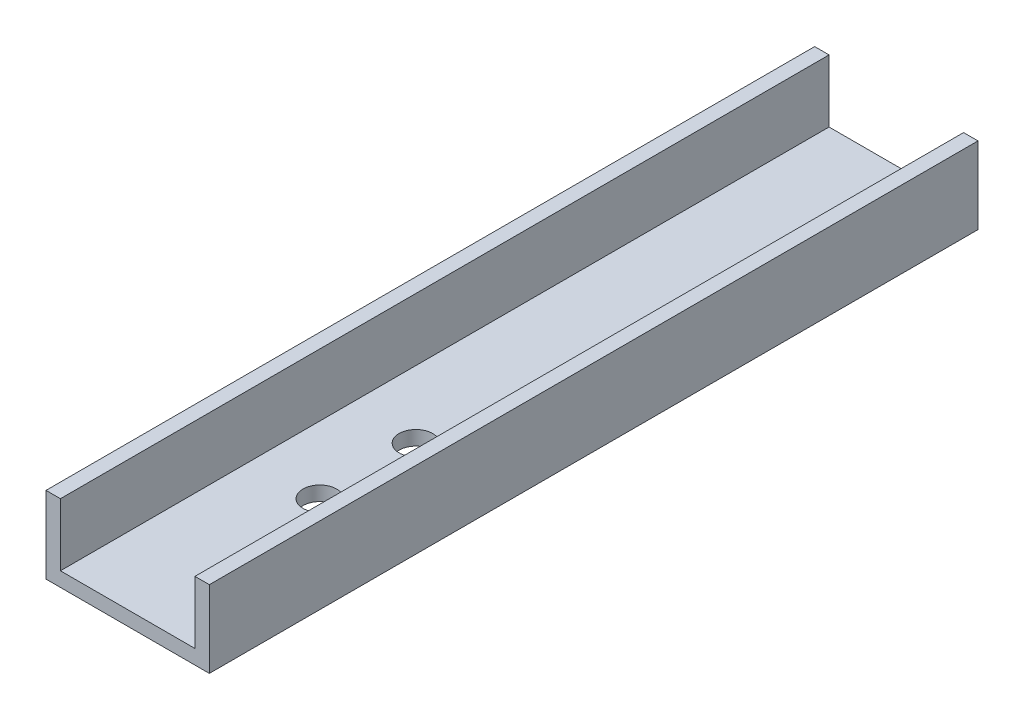
from build123d import *

# Parameters (mm, degrees)
EXTRUDE_1_DEPTH     = 80
SKETCH_2_R          = 1.75
CUT_EXTRUDE_1_DEPTH = 81.847077869


with BuildPart() as part:
    # ｽｹｯﾁ1 → ﾎﾞｽ - 押し出し1 (new body)
    with BuildSketch(Plane.XY):
        Polygon((0, 0), (-7, 0), (-7, 6.5), (-8.5, 6.5), (-8.5, -1.5), (8.5, -1.5), (8.5, 6.5), (7, 6.5), (7, 0), align=None)
    extrude(amount=EXTRUDE_1_DEPTH)

    # ｽｹｯﾁ2 → ｶｯﾄ - 押し出し1 (cut, through all)
    with BuildSketch(Plane.XZ.offset(1.5)):
        with Locations(Location((0, 50, 0), (0, 0, 270))):
            Circle(SKETCH_2_R)
        with Locations(Location((0, 60, 0), (0, 0, 270))):
            Circle(SKETCH_2_R)
    extrude(amount=-CUT_EXTRUDE_1_DEPTH, mode=Mode.SUBTRACT)


solid = part.part
